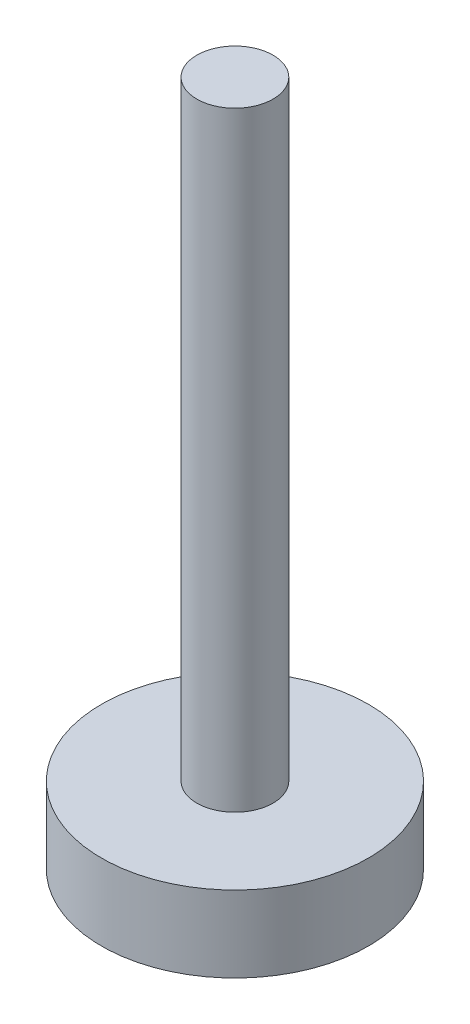
from build123d import *

# Parameters (mm, degrees)
SKETCH_1_R      = 5
EXTRUDE_1_DEPTH = 80
SKETCH_2_R      = 17.5
EXTRUDE_2_DEPTH = 10


with BuildPart() as part:
    # 草图1 → 凸台-拉伸1 (new body)
    with BuildSketch(Plane(origin=(0, 0, 0), x_dir=(1, 0, 0), z_dir=(0, 1, 0))):
        with Locations(Location((0, 0, 0), (0, 0, 270))):
            Circle(SKETCH_1_R)
    extrude(amount=EXTRUDE_1_DEPTH)

    # 草图2 → 凸台-拉伸2 (add)
    with BuildSketch(Plane.XZ):
        with Locations(Location((0, 0, 0), (0, 0, 270))):
            Circle(SKETCH_2_R)
    extrude(amount=EXTRUDE_2_DEPTH)


solid = part.part
